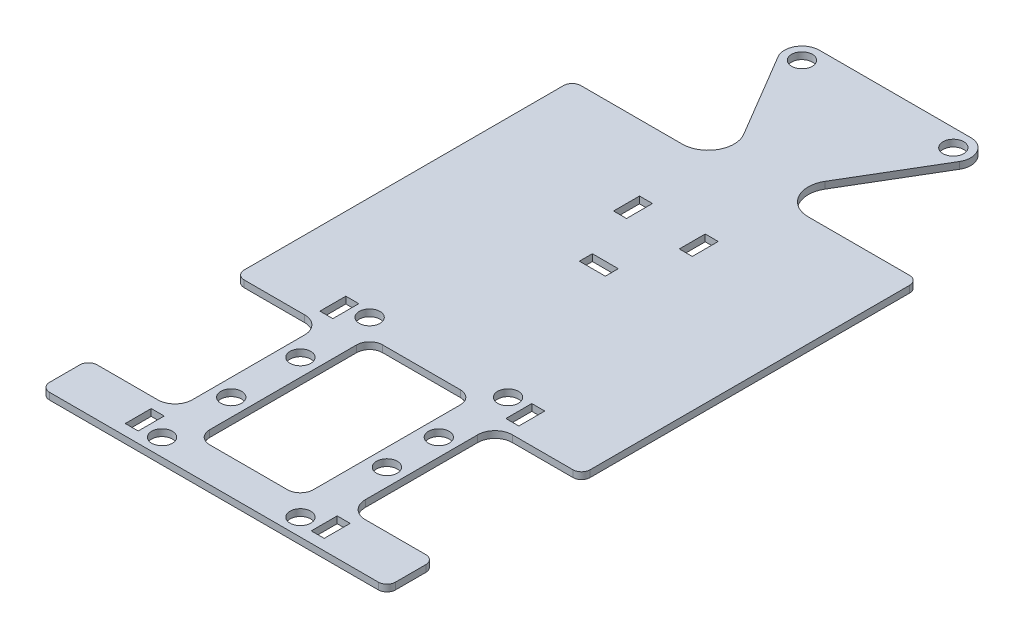
from build123d import *
from OCP.BRepFilletAPI import BRepFilletAPI_MakeFillet

# Parameters (mm, degrees)
SKETCH2_R           = 2.4
BOSS_EXTRUDE1_DEPTH = 1.57
FILLET1_R1          = 4
FILLET1_R2          = 6
FILLET2_R           = 2
SKETCH3_W           = 3
SKETCH3_H           = 6
SKETCH3_W_2         = 6
SKETCH3_H_2         = 3
CUT_EXTRUDE1_DEPTH  = 10


with BuildPart() as part:
    # Sketch2 → Boss-Extrude1 (new body)
    with BuildSketch(Plane(origin=(0, 0, 0), x_dir=(1, 0, 0), z_dir=(0, 1, 0))):
        with BuildLine():
            Line((70.915716682, -126.509753408), (70.915716682, -48.669731747))
            Line((70.915716682, -48.669731747), (34.950716682, -48.669731747))
            Line((34.950716682, -48.669731747), (51.886612754, -20.102447618))
            ThreePointArc((51.886612754, -20.102447618), (51.921713055, -16.04745162), (48.415716682, -14.009753408))
            Line((48.415716682, -14.009753408), (13.415716682, -14.009753408))
            ThreePointArc((13.415716682, -14.009753408), (9.909720309, -16.04745162), (9.944820611, -20.102447618))
            Line((9.944820611, -20.102447618), (26.880716682, -48.669731747))
            Line((26.880716682, -48.669731747), (-9.084283318, -48.669731747))
            Line((-9.084283318, -48.669731747), (-9.084283318, -126.509753408))
            Line((-9.084283318, -126.509753408), (10.915716682, -126.509753408))
            Line((10.915716682, -126.509753408), (10.915716682, -160.509753408))
            Line((10.915716682, -160.509753408), (-9.084283318, -160.509753408))
            Line((-9.084283318, -160.509753408), (-9.084283318, -171.509753408))
            Line((-9.084283318, -171.509753408), (70.915716682, -171.509753408))
            Line((70.915716682, -171.509753408), (70.915716682, -160.509753408))
            Line((70.915716682, -160.509753408), (50.915716682, -160.509753408))
            Line((50.915716682, -160.509753408), (50.915716682, -126.509753408))
            Line((50.915716682, -126.509753408), (70.915716682, -126.509753408))
        make_face()
        with BuildLine():
            Line((42.915716682, -126.509753408), (42.915716682, -160.509753408))
            ThreePointArc((42.915716682, -160.509753408), (42.037037026, -162.631073752), (39.915716682, -163.509753408))
            Line((39.915716682, -163.509753408), (21.915716682, -163.509753408))
            ThreePointArc((21.915716682, -163.509753408), (19.794396339, -162.631073752), (18.915716682, -160.509753408))
            Line((18.915716682, -160.509753408), (18.915716682, -126.509753408))
            ThreePointArc((18.915716682, -126.509753408), (19.794396339, -124.388433064), (21.915716682, -123.509753408))
            Line((21.915716682, -123.509753408), (39.915716682, -123.509753408))
            ThreePointArc((39.915716682, -123.509753408), (42.037037026, -124.388433064), (42.915716682, -126.509753408))
        make_face(mode=Mode.SUBTRACT)
        with Locations((46.915716682, -135.509753408)):
            Circle(SKETCH2_R, mode=Mode.SUBTRACT)
        with Locations((46.915716682, -119.509753408)):
            Circle(SKETCH2_R, mode=Mode.SUBTRACT)
        with Locations((14.915716682, -119.509753408)):
            Circle(SKETCH2_R, mode=Mode.SUBTRACT)
        with Locations((14.915716682, -135.509753408)):
            Circle(SKETCH2_R, mode=Mode.SUBTRACT)
        with Locations((46.915716682, -147.509753408)):
            Circle(SKETCH2_R, mode=Mode.SUBTRACT)
        with Locations((14.915716682, -151.509753408)):
            Circle(SKETCH2_R, mode=Mode.SUBTRACT)
        with Locations((48.415716682, -18.044753408)):
            Circle(SKETCH2_R, mode=Mode.SUBTRACT)
        with Locations((13.415716682, -18.044753408)):
            Circle(SKETCH2_R, mode=Mode.SUBTRACT)
        with Locations((14.915716682, -167.509753408)):
            Circle(SKETCH2_R, mode=Mode.SUBTRACT)
        with Locations((46.915716682, -167.509753408)):
            Circle(SKETCH2_R, mode=Mode.SUBTRACT)
    extrude(amount=BOSS_EXTRUDE1_DEPTH)

    # Fillet1: one fillet with a radius per group of edges: ONE call of the kernel's fillet builder (fillet() takes one radius for all edges)
    fillet1_edges_1 = [part.edges().sort_by_distance(p)[0] for p in [
        (50.915716682, 0.785, 126.509753408),
        (50.915716682, 0.785, 160.509753408),
        (10.915716682, 0.785, 126.509753408),
        (10.915716682, 0.785, 160.509753408),
    ]]
    fillet1_edges_2 = [part.edges().sort_by_distance(p)[0] for p in [
        (26.880716682, 0.785, 48.669731747),
        (34.950716682, 0.785, 48.669731747),
    ]]
    fillet1 = BRepFilletAPI_MakeFillet(part.part.solid().wrapped)
    for e in fillet1_edges_1:
        fillet1.Add(FILLET1_R1, e.wrapped)
    for e in fillet1_edges_2:
        fillet1.Add(FILLET1_R2, e.wrapped)
    add(Compound.cast(fillet1.Shape()), mode=Mode.REPLACE)

    # Fillet2
    fillet2_edges = [part.edges().sort_by_distance(p)[0] for p in [
        (-9.084283318, 0.785, 171.509753408),
        (-9.084283318, 0.785, 160.509753408),
        (-9.084283318, 0.785, 126.509753408),
        (-9.084283318, 0.785, 48.669731747),
        (70.915716682, 0.785, 48.669731747),
        (70.915716682, 0.785, 171.509753408),
        (70.915716682, 0.785, 160.509753408),
        (70.915716682, 0.785, 126.509753408),
    ]]
    fillet(fillet2_edges, radius=FILLET2_R)

    # Sketch3 → Cut-Extrude1 (cut)
    with BuildSketch(Plane(origin=(0, 1.57, 0), x_dir=(1, 0, 0), z_dir=(0, 1, 0))):
        with Locations((9.415716682, -166.009753408)):
            Rectangle(SKETCH3_W, SKETCH3_H)
        with Locations((52.415716682, -166.009753408)):
            Rectangle(SKETCH3_W, SKETCH3_H)
        with Locations((52.415716682, -121.009753408)):
            Rectangle(SKETCH3_W, SKETCH3_H)
        with Locations((9.415716682, -121.009753408)):
            Rectangle(SKETCH3_W, SKETCH3_H)
        with Locations((23.315716682, -67.009753408)):
            Rectangle(SKETCH3_W, SKETCH3_H)
        with Locations((38.515716682, -67.009753408)):
            Rectangle(SKETCH3_W, SKETCH3_H)
        with Locations((30.915716682, -82.509753408)):
            Rectangle(SKETCH3_W_2, SKETCH3_H_2)
    extrude(amount=-CUT_EXTRUDE1_DEPTH, mode=Mode.SUBTRACT)


solid = part.part
